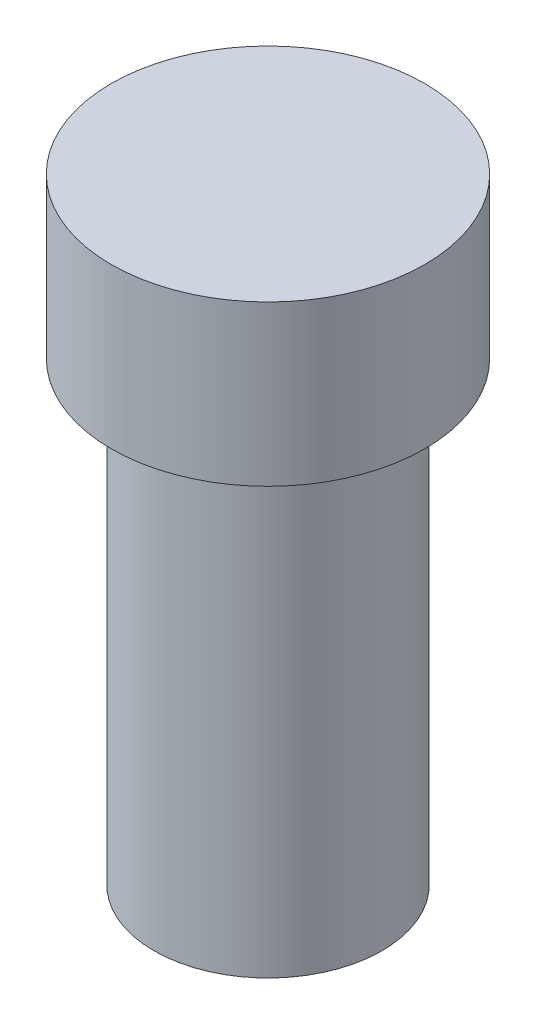
from build123d import *

# Parameters (mm, degrees)
SKETCH1_R           = 2.75
BOSS_EXTRUDE1_DEPTH = 2.8
SKETCH1_3_R         = 2
BOSS_EXTRUDE2_DEPTH = 8


with BuildPart() as part:
    # Sketch1 → Boss-Extrude1 (new body)
    with BuildSketch(Plane(origin=(0, 0, 0), x_dir=(1, 0, 0), z_dir=(0, 1, 0))):
        Circle(SKETCH1_R)
    extrude(amount=BOSS_EXTRUDE1_DEPTH)

    # Sketch1<3> → Boss-Extrude2 (add)
    with BuildSketch(Plane(origin=(0, 0, 0), x_dir=(1, 0, 0), z_dir=(0, 1, 0))):
        Circle(SKETCH1_3_R)
    extrude(amount=-BOSS_EXTRUDE2_DEPTH)


solid = part.part
